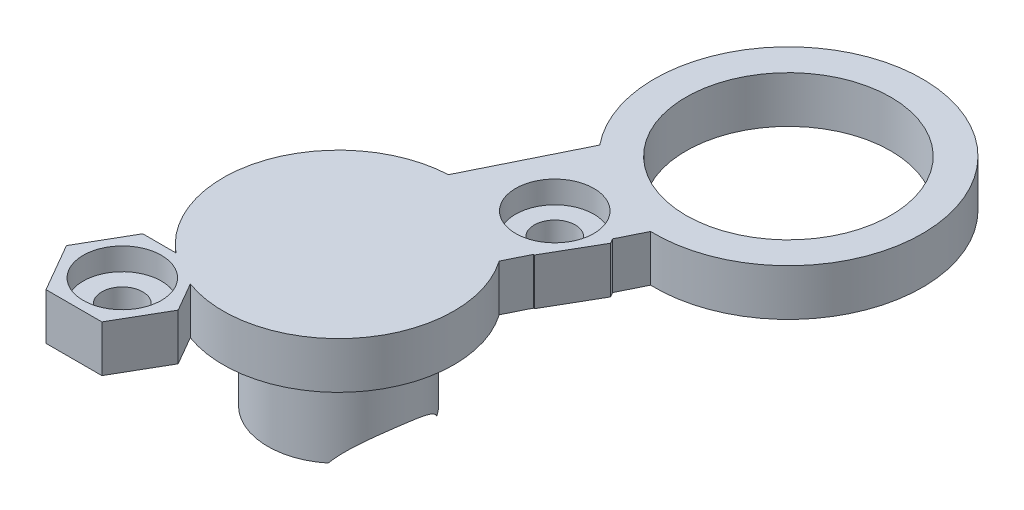
from build123d import *

# Parameters (mm, degrees)
RETAINER_FEATURE_1_PROFILE_R  = 3.8
RETAINER_FEATURE_1_DEPTH      = 5.02
RETAINER_FEATURE_2_PROFILE_R  = 6.2
RETAINER_FEATURE_2_DEPTH      = 2.5
RETAINER_FEATURE_5_DEPTH      = 2.5
RETAINER_FEATURE_8_DEPTH      = 2.5
RETAINER_FEATURE_12_DEPTH     = 2.5
RETAINER_FEATURE_13_PROFILE_R = 7.2
RETAINER_FEATURE_13_DEPTH     = 2.5
RETAINER_FEATURE_14_PROFILE_R = 5.5
RETAINER_FEATURE_14_DEPTH     = 2.7
RETAINER_FEATURE_15_PROFILE_R = 1.1
RETAINER_FEATURE_15_DEPTH     = 3.75
RETAINER_FEATURE_16_PROFILE_R = 2.1
RETAINER_FEATURE_16_DEPTH     = 1.45
RETAINER_FEATURE_17_PROFILE_R = 1.1
RETAINER_FEATURE_17_DEPTH     = 3.75
RETAINER_FEATURE_18_PROFILE_R = 2.1
RETAINER_FEATURE_18_DEPTH     = 1.45


with BuildPart() as part:
    # Retainer Feature 1 profile → Retainer Feature 1 (new body)
    with BuildSketch(Plane(origin=(0, -101, 0), x_dir=(-1, 0, 0), z_dir=(0, -1, 0))):
        with Locations(Location((82.27241336, 15, 0), (0, 0, 90))):
            Circle(RETAINER_FEATURE_1_PROFILE_R)
    extrude(amount=RETAINER_FEATURE_1_DEPTH)

    # Retainer Feature 2 profile → Retainer Feature 2 (add)
    with BuildSketch(Plane(origin=(0, -106, 0), x_dir=(-1, 0, 0), z_dir=(0, -1, 0))):
        with Locations(Location((82.27241336, 15, 0), (0, 0, 90))):
            Circle(RETAINER_FEATURE_2_PROFILE_R)
    extrude(amount=RETAINER_FEATURE_2_DEPTH)

    # Middle Right Floating Compression Ball R → Retainer Feature 5 (add)
    with BuildSketch(Plane(origin=(0, -106, 0), x_dir=(-1, 0, 0), z_dir=(0, -1, 0))):
        Polygon((83.52241336, 7.638784068), (85.02241336, 5.040707856), (88.02241336, 5.040707856), (89.52241336, 7.638784068), (88.02241336, 10.236860279), (85.02241336, 10.236860279), align=None)
    extrude(amount=RETAINER_FEATURE_5_DEPTH)

    # Middle Right Floating Compression Ba 2 → Retainer Feature 8 (add)
    with BuildSketch(Plane(origin=(0, -106, 0), x_dir=(-1, 0, 0), z_dir=(0, -1, 0))):
        Polygon((75.02241336, 22.361215932), (76.52241336, 19.763139721), (79.52241336, 19.763139721), (81.02241336, 22.361215932), (79.52241336, 24.959292144), (76.52241336, 24.959292144), align=None)
    extrude(amount=RETAINER_FEATURE_8_DEPTH)

    # Retainer Feature 9 profile → Retainer Feature 9 (revolve, cut)
    with BuildSketch(Plane(origin=(0, -101, 0), x_dir=(-1, 0, 0), z_dir=(0, -1, 0))):
        with BuildLine():
            Line((82.27241336, 11.85), (82.27241336, 18.15))
            ThreePointArc((82.27241336, 18.15), (79.12241336, 15), (82.27241336, 11.85))
        make_face()
    revolve(axis=Axis((-82.27241336, -101, -25), (0, 0, 1)), mode=Mode.SUBTRACT)

    # Middle Right Floating Compression Ba 3 → Retainer Feature 12 (add)
    with BuildSketch(Plane(origin=(0, -106, 0), x_dir=(-1, 0, 0), z_dir=(0, -1, 0))):
        Polygon((84.962821054, 16.327292899), (76.98205894, 32.504207435), (71.601243552, 29.849621637), (79.582005666, 13.672707101), align=None)
    extrude(amount=RETAINER_FEATURE_12_DEPTH)

    # Retainer Feature 13 profile → Retainer Feature 13 (add)
    with BuildSketch(Plane(origin=(0, -106, 0), x_dir=(-1, 0, 0), z_dir=(0, -1, 0))):
        with Locations((74.291651246, 31.176914536)):
            Circle(RETAINER_FEATURE_13_PROFILE_R)
    extrude(amount=RETAINER_FEATURE_13_DEPTH)

    # Retainer Feature 14 profile → Retainer Feature 14 (cut)
    with BuildSketch(Plane(origin=(0, -105.9, 0), x_dir=(-1, 0, 0), z_dir=(0, -1, 0))):
        with Locations(Location((74.291651246, 31.176914536, 0), (0, 0, 270))):
            Circle(RETAINER_FEATURE_14_PROFILE_R)
    extrude(amount=RETAINER_FEATURE_14_DEPTH, mode=Mode.SUBTRACT)

    # Retainer Feature 15 profile → Retainer Feature 15 (cut)
    with BuildSketch(Plane(origin=(0, -105, 0), x_dir=(-1, 0, 0), z_dir=(0, -1, 0))):
        with Locations(Location((86.52241336, 7.638784068, 0), (0, 0, 90))):
            Circle(RETAINER_FEATURE_15_PROFILE_R)
    extrude(amount=RETAINER_FEATURE_15_DEPTH, mode=Mode.SUBTRACT)

    # Retainer Feature 16 profile → Retainer Feature 16 (cut)
    with BuildSketch(Plane(origin=(0, -107.3, 0), x_dir=(-1, 0, 0), z_dir=(0, -1, 0))):
        with Locations(Location((86.52241336, 7.638784068, 0), (0, 0, 90))):
            Circle(RETAINER_FEATURE_16_PROFILE_R)
    extrude(amount=RETAINER_FEATURE_16_DEPTH, mode=Mode.SUBTRACT)

    # Retainer Feature 17 profile → Retainer Feature 17 (cut)
    with BuildSketch(Plane(origin=(0, -105, 0), x_dir=(-1, 0, 0), z_dir=(0, -1, 0))):
        with Locations(Location((78.02241336, 22.361215932, 0), (0, 0, 90))):
            Circle(RETAINER_FEATURE_17_PROFILE_R)
    extrude(amount=RETAINER_FEATURE_17_DEPTH, mode=Mode.SUBTRACT)

    # Retainer Feature 18 profile → Retainer Feature 18 (cut)
    with BuildSketch(Plane(origin=(0, -107.3, 0), x_dir=(-1, 0, 0), z_dir=(0, -1, 0))):
        with Locations(Location((78.02241336, 22.361215932, 0), (0, 0, 90))):
            Circle(RETAINER_FEATURE_18_PROFILE_R)
    extrude(amount=RETAINER_FEATURE_18_DEPTH, mode=Mode.SUBTRACT)

    # Articulation Throat Sketch → Articulation Throat (revolve, cut)
    with BuildSketch(Plane(origin=(21.848129609, -32.292361412, -7.122138515), x_dir=(-0.8343429620590533, -0.5383086561091639, -0.11872494439026368), z_dir=(0.551245699903886, -0.8147619813060819, -0.17969722356136375))):
        Polygon((124.793457491, -7.104979762), (124.793457491, -4.804979762), (101.793457491, 1.915020238), (101.793457491, -7.104979762), align=None)
    revolve(axis=Axis((-90.61584298, -106.383086561, -16.187249444), (0.8343429620590537, 0.5383086561091633, 0.11872494439026321)), mode=Mode.SUBTRACT)


with BuildPart() as body_2:
    # Mirror1: mirrored copy
    add(part.part.mirror(Plane(origin=(0, 0, 0), x_dir=(0, 0, 1), z_dir=(0, -1, 0))))


solid = body_2.part
